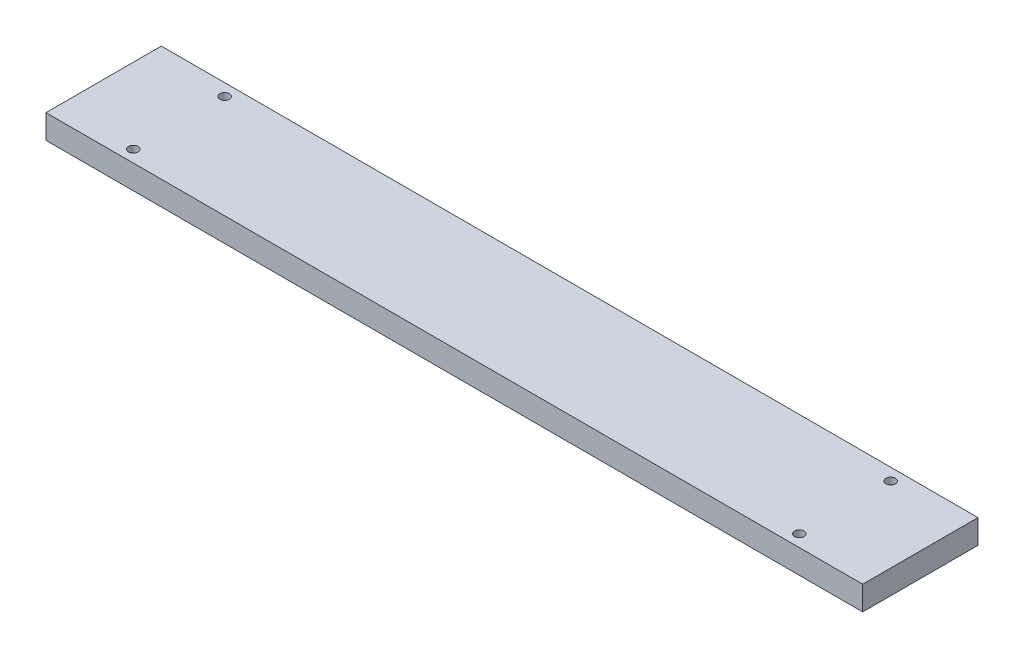
from build123d import *

# Parameters (mm, degrees)
SKETCH1_W           = 850
SKETCH1_H           = 120
BOSS_EXTRUDE1_DEPTH = 25
SKETCH2_R           = 5
CUT_EXTRUDE1_DEPTH  = 25


with BuildPart() as part:
    # Sketch1 → Boss-Extrude1 (new body)
    with BuildSketch(Plane(origin=(0, 0, 0), x_dir=(1, 0, 0), z_dir=(0, 1, 0))):
        Rectangle(SKETCH1_W, SKETCH1_H)
    extrude(amount=BOSS_EXTRUDE1_DEPTH)

    # Sketch2 → Cut-Extrude1 (cut)
    with BuildSketch(Plane(origin=(0, 25, 0), x_dir=(1, 0, 0), z_dir=(0, 1, 0))):
        with Locations(Location((-346.616822539, 47.5, 0), (0, 0, 270))):
            Circle(SKETCH2_R)
        with Locations(Location((-346.616822539, -47.5, 0), (0, 0, 270))):
            Circle(SKETCH2_R)
        with Locations(Location((346.616822539, -47.5, 0), (0, 0, 90))):
            Circle(SKETCH2_R)
        with Locations(Location((346.616822539, 47.5, 0), (0, 0, 90))):
            Circle(SKETCH2_R)
    extrude(amount=-CUT_EXTRUDE1_DEPTH, mode=Mode.SUBTRACT)


solid = part.part
